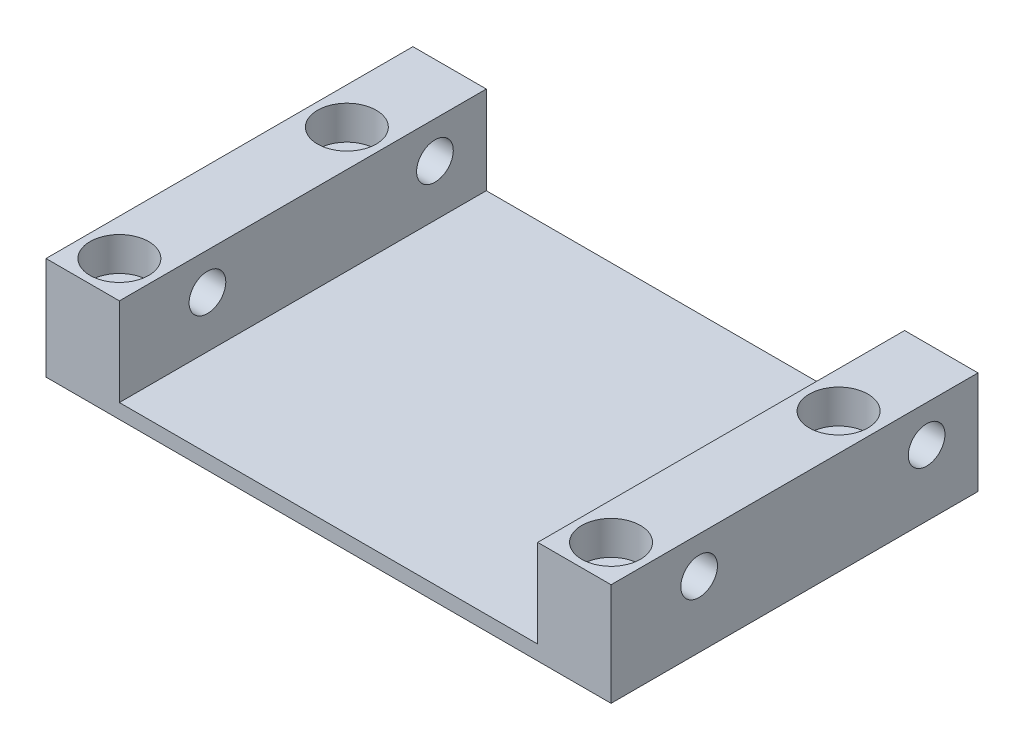
from build123d import *

# Parameters (mm, degrees)
EXTRUDE_1_DEPTH           = 25
SKETCH_4_R                = 2.5
CUT_EXTRUDE_1_DEPTH       = 50
HOLE_WIZARD_2_D           = 4.5
HOLE_WIZARD_2_CBORE_D     = 8
HOLE_WIZARD_2_CBORE_DEPTH = 4.6


with BuildPart() as part:
    # 草图1 → 凸台-拉伸1 (new, symmetric)
    with BuildSketch(Plane.XY):
        Polygon((-28.5, 2), (-28.5, 14), (-38.5, 14), (-38.5, 0), (38.5, 0), (38.5, 14), (28.5, 14), (28.5, 2), align=None)
    extrude(amount=EXTRUDE_1_DEPTH, both=True)

    # 草图4 → 切除-拉伸1 (cut, symmetric)
    with BuildSketch(Plane(origin=(0, 0, 0), x_dir=(0, 0, -1), z_dir=(1, 0, 0))):
        with Locations(Location((18, 9, 0), (0, 0, 90))):
            Circle(SKETCH_4_R)
        with Locations(Location((-13, 9, 0), (0, 0, 90))):
            Circle(SKETCH_4_R)
    extrude(amount=CUT_EXTRUDE_1_DEPTH, both=True, mode=Mode.SUBTRACT)

    # 打孔尺寸根据内六角圆柱头螺钉的类型2 (through all)
    with Locations(Plane(origin=(0, 14, 0), x_dir=(-1, 0, 0), z_dir=(0, 1, 0))):
        with Locations((33.5, -11), (33.5, 20)):
            hole_wizard_2 = CounterBoreHole(HOLE_WIZARD_2_D / 2, HOLE_WIZARD_2_CBORE_D / 2, HOLE_WIZARD_2_CBORE_DEPTH)

    # 镜向2: 打孔尺寸根据内六角圆柱头螺钉的类型2 across plane
    add(hole_wizard_2.mirror(Plane(origin=(0, 0, 0), x_dir=(0, 0, 1), z_dir=(1, 0, 0))), mode=Mode.SUBTRACT)


solid = part.part
